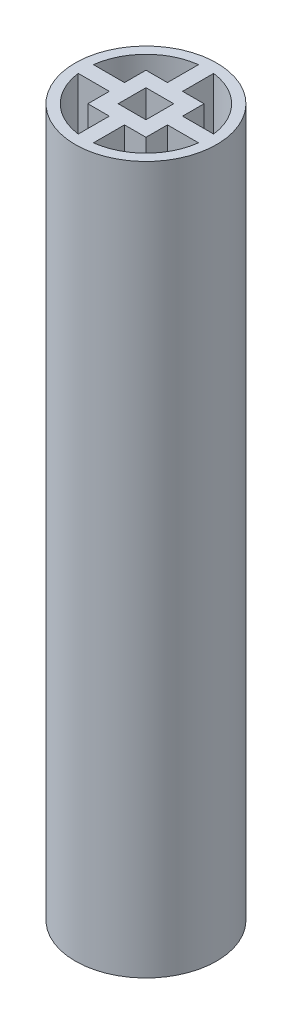
from build123d import *

# Parameters (mm, degrees)
SKETCH1_R  = 14
SKETCH1_W  = 5.5
SKETCH1_H  = 5.5
BODY_DEPTH = 70


with BuildPart() as part:
    # Sketch1 → Body (new, symmetric)
    with BuildSketch(Plane(origin=(0, 0, 0), x_dir=(1, 0, 0), z_dir=(0, 1, 0))):
        with Locations(Location((0, 0, 0), (0, 0, 270))):
            Circle(SKETCH1_R)
        with BuildLine():
            Line((-5.75, 1.5), (-11.9058809, 1.5))
            ThreePointArc((-11.9058809, 1.5), (-8.485281374, 8.485281374), (-1.5, 11.9058809))
            Line((-1.5, 11.9058809), (-1.5, 5.75))
            Line((-1.5, 5.75), (-5.75, 5.75))
            Line((-5.75, 5.75), (-5.75, 1.5))
        make_face(mode=Mode.SUBTRACT)
        with BuildLine():
            Line((5.75, -5.75), (1.5, -5.75))
            Line((1.5, -5.75), (1.5, -11.9058809))
            ThreePointArc((1.5, -11.9058809), (8.485281374, -8.485281374), (11.9058809, -1.5))
            Line((11.9058809, -1.5), (5.75, -1.5))
            Line((5.75, -1.5), (5.75, -5.75))
        make_face(mode=Mode.SUBTRACT)
        with BuildLine():
            Line((5.75, 5.75), (1.5, 5.75))
            Line((1.5, 5.75), (1.5, 11.9058809))
            ThreePointArc((1.5, 11.9058809), (8.485281374, 8.485281374), (11.9058809, 1.5))
            Line((11.9058809, 1.5), (5.75, 1.5))
            Line((5.75, 1.5), (5.75, 5.75))
        make_face(mode=Mode.SUBTRACT)
        with BuildLine():
            Line((-5.75, -5.75), (-5.75, -1.5))
            Line((-5.75, -1.5), (-11.9058809, -1.5))
            ThreePointArc((-11.9058809, -1.5), (-8.485281374, -8.485281374), (-1.5, -11.9058809))
            Line((-1.5, -11.9058809), (-1.5, -5.75))
            Line((-1.5, -5.75), (-5.75, -5.75))
        make_face(mode=Mode.SUBTRACT)
        Rectangle(SKETCH1_W, SKETCH1_H, mode=Mode.SUBTRACT)
    extrude(amount=BODY_DEPTH, both=True)


solid = part.part
